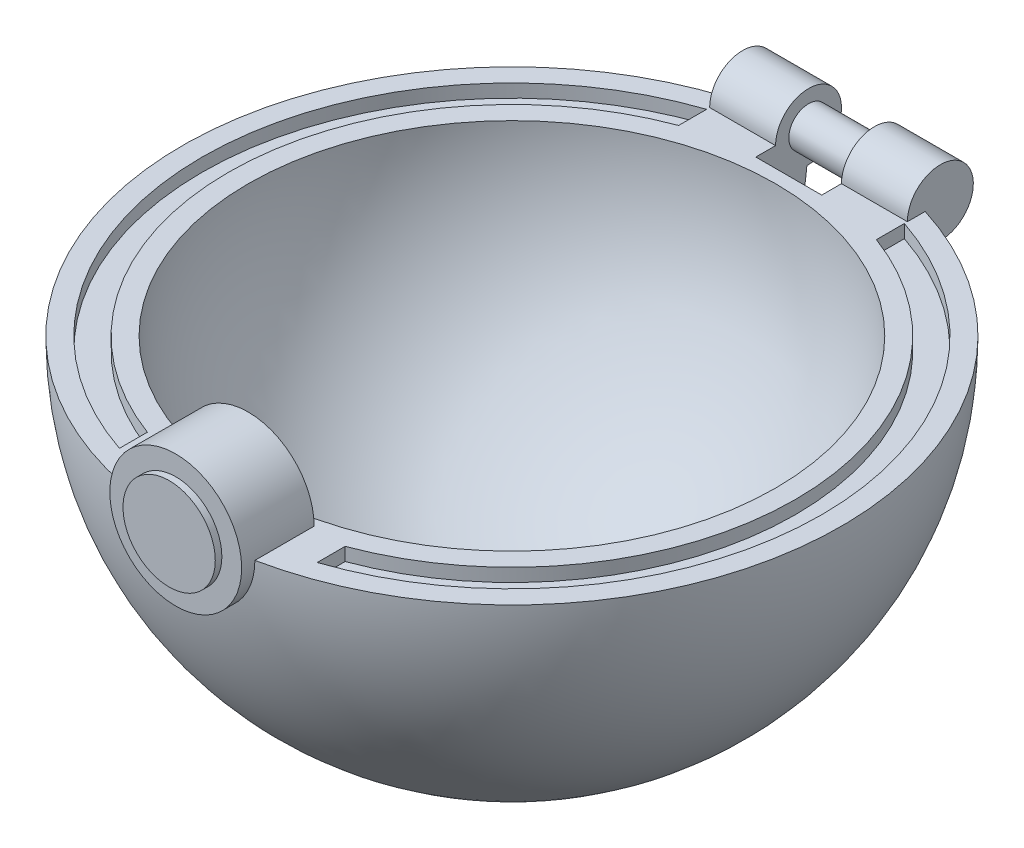
from build123d import *

# Parameters (mm, degrees)
CUT_EXTRUDE1_DEPTH       = 15
CUT_EXTRUDE1_DEPTH_BACK  = 15
SKETCH5_R                = 8
BOSS_EXTRUDE1_DEPTH      = 15
BOSS_EXTRUDE1_DEPTH_BACK = 15
SKETCH6_R                = 5
CUT_EXTRUDE2_DEPTH       = 5
CUT_EXTRUDE2_DEPTH_BACK  = 5
SKETCH7_R                = 5
BOSS_EXTRUDE2_DEPTH      = 5
BOSS_EXTRUDE2_DEPTH_BACK = 5
SKETCH8_R                = 3
SKETCH9_W                = 10
SKETCH9_H                = 5
BOSS_EXTRUDE3_DEPTH      = 10
LPATTERN1_COUNT          = 2
LPATTERN1_PITCH          = 20
BOSS_EXTRUDE4_DEPTH      = 1
BOSS_EXTRUDE4_DEPTH_BACK = 10
SKETCH10_R               = 10
SKETCH11_R               = 7
BOSS_EXTRUDE5_DEPTH      = 2
CUT_EXTRUDE5_DEPTH       = 2
BOSS_EXTRUDE6_DEPTH      = 15
BOSS_EXTRUDE6_DEPTH_BACK = 15
CUT_EXTRUDE6_DEPTH       = 5
CUT_EXTRUDE6_DEPTH_BACK  = 5
SKETCH15_R               = 10
CUT_EXTRUDE7_DEPTH       = 1


with BuildPart() as part:
    # Sketch3 → Revolve2 (revolve)
    with BuildSketch(Plane(origin=(0, 0, 0), x_dir=(0, 0, -1), z_dir=(1, 0, 0))):
        with BuildLine():
            Line((50, 0), (40, 0))
            ThreePointArc((40, 0), (28.284271247, -28.284271247), (0, -40))
            Line((0, -40), (0, -50))
            ThreePointArc((0, -50), (35.355339059, -35.355339059), (50, 0))
        make_face()
    revolve(axis=Axis((0, 0, 0), (0, 1, 0)))

    # Sketch5 → Cut-Extrude1 (cut, two sides: drawn at the far end of the back side and taken through both)
    with BuildSketch(Plane(origin=(0, 0, 0), x_dir=(0, 0, -1), z_dir=(1, 0, 0)).offset(-CUT_EXTRUDE1_DEPTH_BACK)):
        with Locations((50, 0)):
            Circle(SKETCH5_R)
    extrude(amount=CUT_EXTRUDE1_DEPTH + CUT_EXTRUDE1_DEPTH_BACK, mode=Mode.SUBTRACT)

    # Sketch6 → Boss-Extrude1 (add, two sides: drawn at the far end of the back side and taken through both)
    with BuildSketch(Plane(origin=(0, 0, 0), x_dir=(0, 0, -1), z_dir=(1, 0, 0)).offset(-BOSS_EXTRUDE1_DEPTH_BACK)):
        with Locations((50, 0)):
            Circle(SKETCH6_R)
    extrude(amount=BOSS_EXTRUDE1_DEPTH + BOSS_EXTRUDE1_DEPTH_BACK)

    # Sketch7 → Cut-Extrude2 (cut, two sides: drawn at the far end of the back side and taken through both)
    with BuildSketch(Plane(origin=(0, 0, 0), x_dir=(0, 0, -1), z_dir=(1, 0, 0)).offset(-CUT_EXTRUDE2_DEPTH_BACK)):
        with Locations((50, 0)):
            Circle(SKETCH7_R)
    extrude(amount=CUT_EXTRUDE2_DEPTH + CUT_EXTRUDE2_DEPTH_BACK, mode=Mode.SUBTRACT)

    # Sketch8 → Boss-Extrude2 (add, two sides: drawn at the far end of the back side and taken through both)
    with BuildSketch(Plane(origin=(0, 0, 0), x_dir=(0, 0, -1), z_dir=(1, 0, 0)).offset(-BOSS_EXTRUDE2_DEPTH_BACK)):
        with Locations((50, 0)):
            Circle(SKETCH8_R)
    extrude(amount=BOSS_EXTRUDE2_DEPTH + BOSS_EXTRUDE2_DEPTH_BACK)

    # Sketch9 → Boss-Extrude3 (add)
    with BuildSketch(Plane(origin=(15, 0, 0), x_dir=(0, 0, -1), z_dir=(1, 0, 0))):
        with Locations((45, -2.5)):
            Rectangle(SKETCH9_W, SKETCH9_H)
    boss_extrude3 = extrude(amount=-BOSS_EXTRUDE3_DEPTH)

    # LPattern1: Boss-Extrude3 ×2
    with Locations(*[(-i * LPATTERN1_PITCH, 0, 0) for i in range(1, LPATTERN1_COUNT)]):
        add(boss_extrude3)

    # Sketch10 → Boss-Extrude4 (add, two sides: drawn at the far end of the back side and taken through both)
    with BuildSketch(Plane.XY.offset(50).offset(-BOSS_EXTRUDE4_DEPTH_BACK)):
        Circle(SKETCH10_R)
    extrude(amount=BOSS_EXTRUDE4_DEPTH + BOSS_EXTRUDE4_DEPTH_BACK)

    # Sketch11 → Boss-Extrude5 (add)
    with BuildSketch(Plane.XY.offset(50)):
        Circle(SKETCH11_R)
    extrude(amount=BOSS_EXTRUDE5_DEPTH)

    # Sketch12 → Cut-Extrude5 (cut)
    with BuildSketch(Plane(origin=(0, 0, 0), x_dir=(1, 0, 0), z_dir=(0, 1, 0))):
        with BuildLine():
            Line((-15, 44.542094894), (-15, 40.298883359))
            ThreePointArc((-15, 40.298883359), (-43, 0), (-15, -40.298883359))
            Line((-15, -40.298883359), (-15, -44.542094894))
            ThreePointArc((-15, -44.542094894), (-46.999981038, 0), (-15, 44.542094894))
        make_face()
        with BuildLine():
            Line((15, 44.542094894), (15, 40.298883359))
            ThreePointArc((15, 40.298883359), (43, 0), (15, -40.298883359))
            Line((15, -40.298883359), (15, -44.542094894))
            ThreePointArc((15, -44.542094894), (46.999981038, 0), (15, 44.542094894))
        make_face()
    extrude(amount=-CUT_EXTRUDE5_DEPTH, mode=Mode.SUBTRACT)

    # Sketch13 → Boss-Extrude6 (add, two sides: drawn at the far end of the back side and taken through both)
    with BuildSketch(Plane(origin=(0, 0, 0), x_dir=(0, 0, -1), z_dir=(1, 0, 0)).offset(-BOSS_EXTRUDE6_DEPTH_BACK)):
        with BuildLine():
            Line((49.749371855, -5), (40, -5))
            Line((40, -5), (40, -8))
            Line((40, -8), (49.355850717, -8))
            ThreePointArc((49.355850717, -8), (49.57530923, -6.502977374), (49.749371855, -5))
        make_face()
    extrude(amount=BOSS_EXTRUDE6_DEPTH + BOSS_EXTRUDE6_DEPTH_BACK)

    # Sketch14 → Cut-Extrude6 (cut, two sides: drawn at the far end of the back side and taken through both)
    with BuildSketch(Plane(origin=(0, 0, 0), x_dir=(0, 0, -1), z_dir=(1, 0, 0)).offset(-CUT_EXTRUDE6_DEPTH_BACK)):
        with BuildLine():
            Line((49.749371855, -5), (40, -5))
            Line((40, -5), (40, -8))
            Line((40, -8), (49.355850717, -8))
            ThreePointArc((49.355850717, -8), (49.57530923, -6.502977374), (49.749371855, -5))
        make_face()
    extrude(amount=CUT_EXTRUDE6_DEPTH + CUT_EXTRUDE6_DEPTH_BACK, mode=Mode.SUBTRACT)

    # Sketch15 → Cut-Extrude7 (cut)
    with BuildSketch(Plane(origin=(0, -50, 0), x_dir=(1, 0, 0), z_dir=(0, 1, 0))):
        Circle(SKETCH15_R)
    extrude(amount=CUT_EXTRUDE7_DEPTH, mode=Mode.SUBTRACT)


solid = part.part
